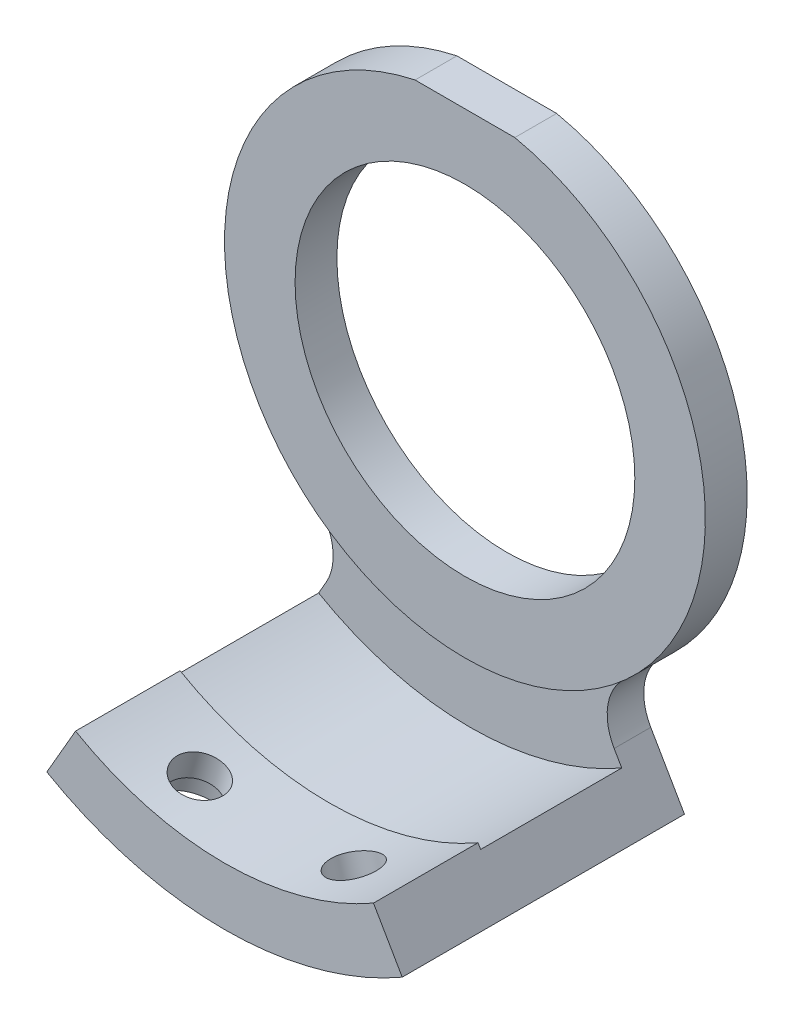
from build123d import *

# Parameters (mm, degrees)
SKETCH_1_R                          = 23
SKETCH_1_R_2                        = 16.25
EXTRUDE_1_DEPTH                     = 4
SKETCH_2_W                          = 9.539392014
SKETCH_2_H                          = 6.996470021
CUT_EXTRUDE_1_DEPTH                 = 14
EXTRUDE_2_DEPTH                     = 3.5
EXTRUDE_3_DEPTH                     = 27
FILLET_1_R                          = 5
EXTRUDE_START                       = -10
EXTRUDE_4_DEPTH                     = 10
HOLE_WIZARD_1_D                     = 4.5
HOLE_WIZARD_1_CBORE_D               = 7.5
HOLE_WIZARD_1_CBORE_DEPTH           = 3
HOLE_WIZARD_1_ON_FACE_2_D           = 4.5
HOLE_WIZARD_1_ON_FACE_2_CBORE_D     = 7.5
HOLE_WIZARD_1_ON_FACE_2_CBORE_DEPTH = 3


with BuildPart() as part:
    # 草图1 → 凸台-拉伸1 (new body)
    with BuildSketch(Plane.XY):
        Circle(SKETCH_1_R)
        Circle(SKETCH_1_R_2, mode=Mode.SUBTRACT)
    extrude(amount=EXTRUDE_1_DEPTH)

    # 草图2 → 切除-拉伸1 (cut)
    with BuildSketch(Plane.XY):
        with Locations((0, 25.998235011)):
            Rectangle(SKETCH_2_W, SKETCH_2_H)
    extrude(amount=CUT_EXTRUDE_1_DEPTH, mode=Mode.SUBTRACT)

    # 草图3 → 凸台-拉伸2 (add)
    with BuildSketch(Plane.XY):
        with BuildLine():
            Line((-11.5, -19.918584287), (-14.5, -25.11473671))
            ThreePointArc((-14.5, -25.11473671), (0, -29), (14.5, -25.11473671))
            Line((14.5, -25.11473671), (11.5, -19.918584287))
            ThreePointArc((11.5, -19.918584287), (0, -23), (-11.5, -19.918584287))
        make_face()
    extrude(amount=EXTRUDE_2_DEPTH)

    # 草图3<3> → 凸台-拉伸3 (add)
    with BuildSketch(Plane.XY):
        with BuildLine():
            ThreePointArc((14.5, -25.11473671), (0, -29), (-14.5, -25.11473671))
            Line((-14.5, -25.11473671), (-17, -29.444863729))
            ThreePointArc((-17, -29.444863729), (0, -34), (17, -29.444863729))
            Line((17, -29.444863729), (14.5, -25.11473671))
        make_face()
    extrude(amount=EXTRUDE_3_DEPTH)

    # 圆角1
    fillet_1_edges = [part.edges().sort_by_distance(p)[0] for p in [
        (-11.5, -19.918584287, 1.75),
        (11.5, -19.918584287, 1.75),
    ]]
    fillet(fillet_1_edges, radius=FILLET_1_R)

    # 草图4 → 凸台-拉伸4 (add)
    with BuildSketch(Plane.XY.offset(27).offset(EXTRUDE_START)):
        with BuildLine():
            ThreePointArc((-17, -29.444863729), (0, -34), (17, -29.444863729))
            Line((17, -29.444863729), (14.25, -24.681724008))
            ThreePointArc((14.25, -24.681724008), (0, -28.5), (-14.25, -24.681724008))
            Line((-14.25, -24.681724008), (-17, -29.444863729))
        make_face()
    extrude(amount=EXTRUDE_4_DEPTH)

    # 孔1 (through all)
    with Locations(Plane(origin=(-8.799847533, -32.841478094, 22), x_dir=(-0.965925826289, 0.258819045103, 0), z_dir=(-0.258819045103, -0.965925826289, 0))):
        with Locations((1e-09, 0)):
            CounterBoreHole(HOLE_WIZARD_1_D / 2, HOLE_WIZARD_1_CBORE_D / 2, HOLE_WIZARD_1_CBORE_DEPTH)

    # 孔1 on face 2 (through all)
    with Locations(Plane(origin=(8.799847533, -32.841478094, 22), x_dir=(-0.965925849201, -0.258818959594, 0), z_dir=(0.258818959594, -0.965925849201, 0))):
        with Locations((-1e-09, 0)):
            CounterBoreHole(HOLE_WIZARD_1_ON_FACE_2_D / 2, HOLE_WIZARD_1_ON_FACE_2_CBORE_D / 2, HOLE_WIZARD_1_ON_FACE_2_CBORE_DEPTH)


solid = part.part
